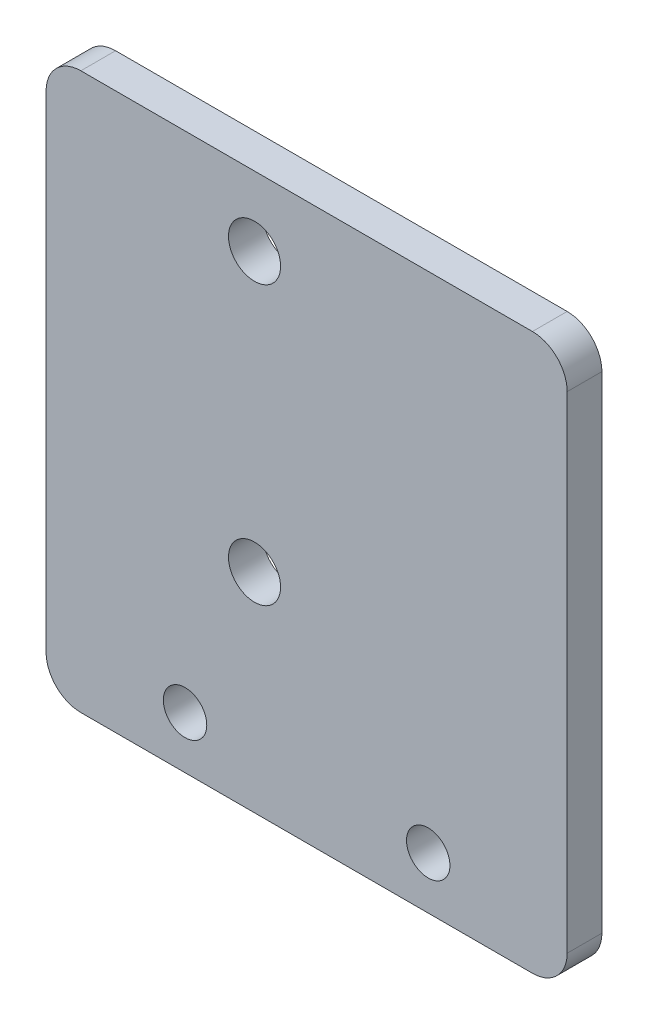
from build123d import *

# Parameters (mm, degrees)
SKETCH_1_W      = 30
SKETCH_1_H      = 32
SKETCH_1_R      = 1.25
SKETCH_1_R_2    = 1.5
EXTRUDE_1_DEPTH = 2
FILLET_1_R      = 2


with BuildPart() as part:
    # ｽｹｯﾁ1 → ﾎﾞｽ - 押し出し1 (new body)
    with BuildSketch(Plane.XY):
        with Locations((15, 16)):
            Rectangle(SKETCH_1_W, SKETCH_1_H)
        with Locations((8, 3)):
            Circle(SKETCH_1_R, mode=Mode.SUBTRACT)
        with Locations((22, 3)):
            Circle(SKETCH_1_R, mode=Mode.SUBTRACT)
        with Locations((12, 28)):
            Circle(SKETCH_1_R_2, mode=Mode.SUBTRACT)
        with Locations((12, 12)):
            Circle(SKETCH_1_R_2, mode=Mode.SUBTRACT)
    extrude(amount=EXTRUDE_1_DEPTH)

    # ﾌｨﾚｯﾄ1
    fillet_1_edges = [part.edges().sort_by_distance(p)[0] for p in [
        (0, 32, 1),
        (30, 32, 1),
        (30, 0, 1),
        (0, 0, 1),
    ]]
    fillet(fillet_1_edges, radius=FILLET_1_R)


solid = part.part
